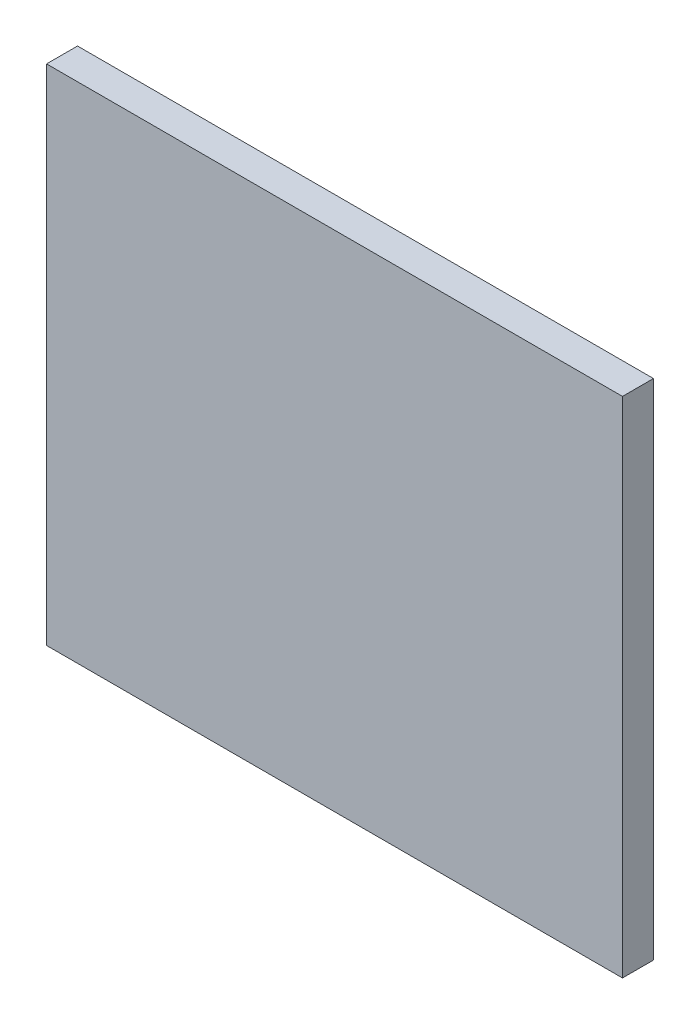
from build123d import *

# Parameters (mm, degrees)
CROQUIS2_W              = 244
CROQUIS2_H              = 279
SALIENTE_EXTRUIR1_DEPTH = 15


with BuildPart() as part:
    # Croquis2 → Saliente-Extruir1 (new body)
    with BuildSketch(Plane(origin=(0, 0, 0), x_dir=(0, 1, 0), z_dir=(0, 0, 1))):
        with Locations((122, 139.5)):
            Rectangle(CROQUIS2_W, CROQUIS2_H)
    extrude(amount=SALIENTE_EXTRUIR1_DEPTH)


solid = part.part
